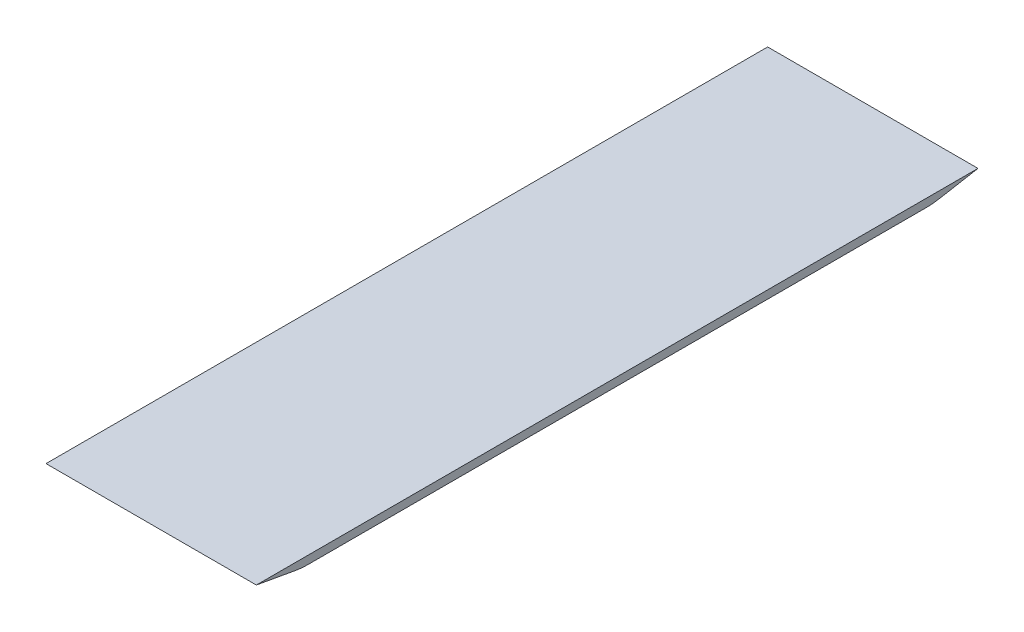
from build123d import *

# Parameters (mm, degrees)
BOSS_EXTRUDE1_DEPTH = 130
FILLET1_R           = 50


with BuildPart() as part:
    # Sketch1 → Boss-Extrude1 (new body)
    with BuildSketch(Plane(origin=(0, 0, 0), x_dir=(0, 0, -1), z_dir=(1, 0, 0))):
        Polygon((0, 0), (446, 0), (418, -5), (28, -5), align=None)
    extrude(amount=BOSS_EXTRUDE1_DEPTH)

    # Fillet1
    fillet1_edges = [part.edges().sort_by_distance(p)[0] for p in [
        (65, -5, -28),
        (65, -5, -418),
    ]]
    fillet(fillet1_edges, radius=FILLET1_R)


solid = part.part
